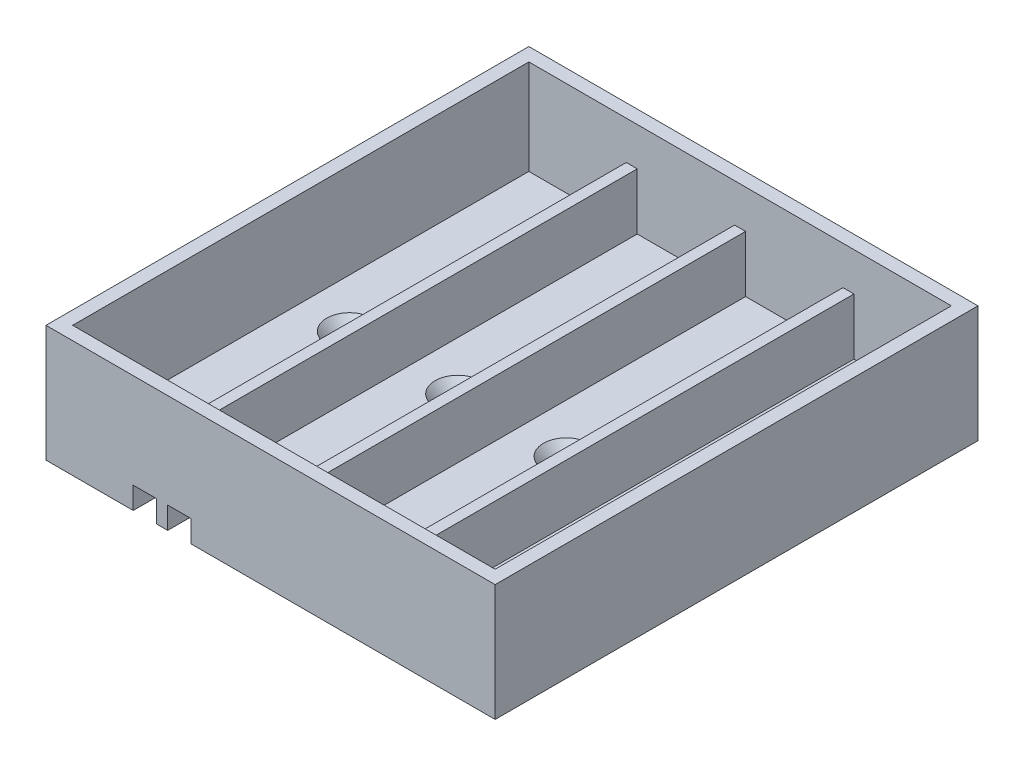
from build123d import *

# Parameters (mm, degrees)
SKETCH_1_W          = 57.3
SKETCH_1_H          = 61.6
EXTRUDE_1_DEPTH     = 2.8
SKETCH_1_11_W       = 57.3
SKETCH_1_11_H       = 61.6
SKETCH_1_11_W_2     = 53.9
SKETCH_1_11_H_2     = 58.2
EXTRUDE_1_2_DEPTH   = 14.9
SKETCH_1_13_W       = 3
SKETCH_1_13_H       = 6.8
CUT_EXTRUDE_1_DEPTH = 2.8
SKETCH_1_14_W       = 1.4
SKETCH_1_14_H       = 61.6
EXTRUDE_2_DEPTH     = 10
SKETCH_1_15_R       = 1.9
CUT_EXTRUDE_2_DEPTH = 45.625917358
CHAMFER_1_SIZE      = 1


with BuildPart() as part:
    # 草图1 → Extrude 1 (new body)
    with BuildSketch(Plane(origin=(0, 0, 0), x_dir=(1, 0, 0), z_dir=(0, 1, 0))):
        Rectangle(SKETCH_1_W, SKETCH_1_H)
    extrude(amount=EXTRUDE_1_DEPTH)

    # 草图1<11> → Extrude 1 2 (add)
    with BuildSketch(Plane(origin=(0, 0, 0), x_dir=(1, 0, 0), z_dir=(0, 1, 0))):
        Rectangle(SKETCH_1_11_W, SKETCH_1_11_H)
        Rectangle(SKETCH_1_11_W_2, SKETCH_1_11_H_2, mode=Mode.SUBTRACT)
    extrude(amount=EXTRUDE_1_2_DEPTH)

    # 草图1<13> → 切除-拉伸1 (cut)
    with BuildSketch(Plane(origin=(0, 0, 0), x_dir=(1, 0, 0), z_dir=(0, 1, 0))):
        with Locations((-16.025, -27.4)):
            Rectangle(SKETCH_1_13_W, SKETCH_1_13_H)
        with Locations((-11.625, -27.4)):
            Rectangle(SKETCH_1_13_W, SKETCH_1_13_H)
    extrude(amount=CUT_EXTRUDE_1_DEPTH, mode=Mode.SUBTRACT)

    # 草图1<14> → 凸台-拉伸2 (add)
    with BuildSketch(Plane(origin=(0, 0, 0), x_dir=(1, 0, 0), z_dir=(0, 1, 0))):
        with Locations((-13.825, 0)):
            Rectangle(SKETCH_1_14_W, SKETCH_1_14_H)
        with Locations((13.825, 0)):
            Rectangle(SKETCH_1_14_W, SKETCH_1_14_H)
        Rectangle(SKETCH_1_14_W, SKETCH_1_14_H)
    extrude(amount=EXTRUDE_2_DEPTH)

    # 草图1<15> → 切除-拉伸2 (cut, through all)
    with BuildSketch(Plane(origin=(0, 0, 0), x_dir=(1, 0, 0), z_dir=(0, 1, 0))):
        with Locations(Location((-20.7375, 0, 0), (0, 0, 270))):
            Circle(SKETCH_1_15_R)
        with Locations(Location((-6.9125, 0, 0), (0, 0, 270))):
            Circle(SKETCH_1_15_R)
        with Locations(Location((6.9125, 0, 0), (0, 0, 270))):
            Circle(SKETCH_1_15_R)
        with Locations(Location((20.7375, 0, 0), (0, 0, 270))):
            Circle(SKETCH_1_15_R)
    extrude(amount=CUT_EXTRUDE_2_DEPTH, mode=Mode.SUBTRACT)

    # 倒角1
    chamfer_1_edges = [part.edges().sort_by_distance(p)[0] for p in [
        (-20.7375, 2.8, -1.9),
        (-6.9125, 2.8, -1.9),
        (6.9125, 2.8, -1.9),
        (20.7375, 2.8, -1.9),
    ]]
    chamfer(chamfer_1_edges, length=CHAMFER_1_SIZE)


solid = part.part
